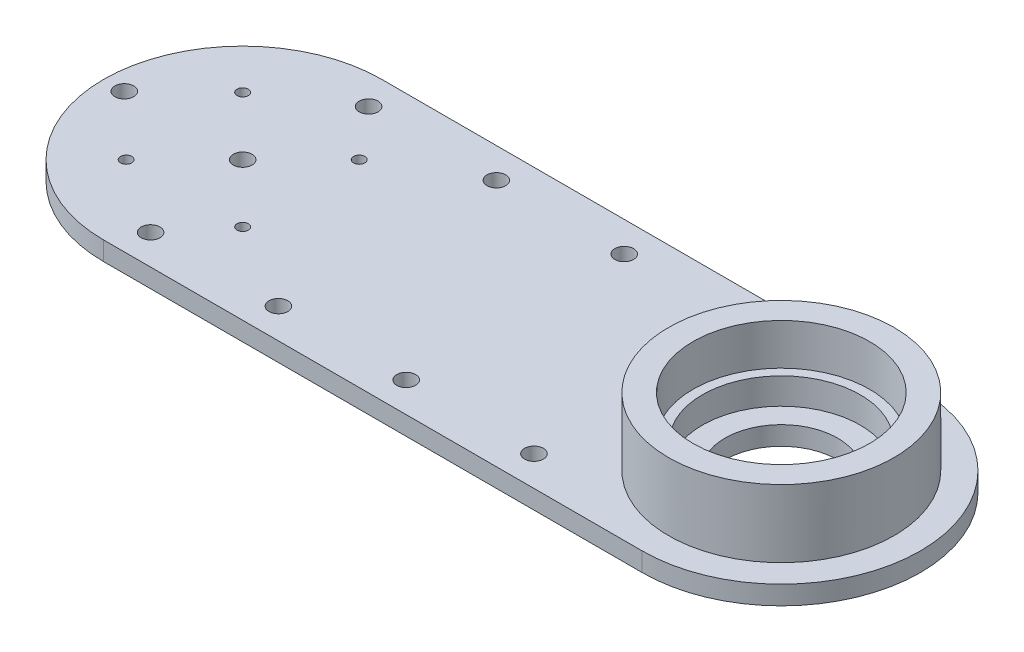
from build123d import *

# Parameters (mm, degrees)
BOSS_EXTRUDE1_DEPTH = 5
SKETCH2_R           = 2.5
SKETCH2_R_2         = 1.5
SKETCH2_R_3         = 15
CUT_EXTRUDE1_DEPTH  = 5
SKETCH3_R           = 2.5
CUT_EXTRUDE2_DEPTH  = 5
SKETCH4_R           = 23.5
SKETCH4_R_2         = 21.000952359
BOSS_EXTRUDE2_DEPTH = 7
SKETCH5_R           = 30.000666659
SKETCH5_R_2         = 23.5
BOSS_EXTRUDE3_DEPTH = 18


with BuildPart() as part:
    # Sketch1 → Boss-Extrude1 (new body)
    with BuildSketch(Plane(origin=(0, 0, 0), x_dir=(1, 0, 0), z_dir=(0, 1, 0))):
        with BuildLine():
            Line((0, 37), (143.3, 37))
            ThreePointArc((143.3, 37), (180.3, 0), (143.3, -37))
            Line((143.3, -37), (0, -37))
            ThreePointArc((0, -37), (-37, 0), (0, 37))
        make_face()
    extrude(amount=BOSS_EXTRUDE1_DEPTH)

    # Sketch2 → Cut-Extrude1 (cut)
    with BuildSketch(Plane(origin=(0, 5, 0), x_dir=(1, 0, 0), z_dir=(0, 1, 0))):
        with Locations(Location((0, 0, 0), (0, 0, 270))):
            Circle(SKETCH2_R)
        with Locations(Location((-15.5, 15.5, 0), (0, 0, 270))):
            Circle(SKETCH2_R_2)
        with Locations(Location((15.5, 15.5, 0), (0, 0, 270))):
            Circle(SKETCH2_R_2)
        with Locations(Location((15.5, -15.5, 0), (0, 0, 270))):
            Circle(SKETCH2_R_2)
        with Locations(Location((-15.5, -15.5, 0), (0, 0, 270))):
            Circle(SKETCH2_R_2)
        with Locations(Location((143.3, 0, 0), (0, 0, 270))):
            Circle(SKETCH2_R_3)
    extrude(amount=-CUT_EXTRUDE1_DEPTH, mode=Mode.SUBTRACT)

    # Sketch3 → Cut-Extrude2 (cut)
    with BuildSketch(Plane(origin=(0, 5, 0), x_dir=(1, 0, 0), z_dir=(0, 1, 0))):
        with Locations(Location((-31.5, 0, 0), (0, 0, 270))):
            Circle(SKETCH3_R)
        with Locations(Location((4.5, -29, 0), (0, 0, 270))):
            Circle(SKETCH3_R)
        with Locations(Location((38.5, -29, 0), (0, 0, 270))):
            Circle(SKETCH3_R)
        with Locations(Location((72.5, -29, 0), (0, 0, 270))):
            Circle(SKETCH3_R)
        with Locations(Location((106.5, -29, 0), (0, 0, 270))):
            Circle(SKETCH3_R)
        with Locations(Location((4.5, 29, 0), (0, 0, 270))):
            Circle(SKETCH3_R)
        with Locations(Location((38.5, 29, 0), (0, 0, 270))):
            Circle(SKETCH3_R)
        with Locations(Location((72.5, 29, 0), (0, 0, 270))):
            Circle(SKETCH3_R)
        with Locations(Location((106.5, 29, 0), (0, 0, 270))):
            Circle(SKETCH3_R)
    extrude(amount=-CUT_EXTRUDE2_DEPTH, mode=Mode.SUBTRACT)

    # Sketch4 → Boss-Extrude2 (add)
    with BuildSketch(Plane(origin=(0, 5, 0), x_dir=(1, 0, 0), z_dir=(0, 1, 0))):
        with Locations(Location((143.3, 0, 0), (0, 0, 270))):
            Circle(SKETCH4_R)
        with Locations(Location((143.3, 0, 0), (0, 0, 270))):
            Circle(SKETCH4_R_2, mode=Mode.SUBTRACT)
    extrude(amount=BOSS_EXTRUDE2_DEPTH)

    # Sketch5 → Boss-Extrude3 (add)
    with BuildSketch(Plane(origin=(0, 5, 0), x_dir=(1, 0, 0), z_dir=(0, 1, 0))):
        with Locations(Location((143.3, 0, 0), (0, 0, 90))):
            Circle(SKETCH5_R)
        with Locations(Location((143.3, 0, 0), (0, 0, 270))):
            Circle(SKETCH5_R_2, mode=Mode.SUBTRACT)
    extrude(amount=BOSS_EXTRUDE3_DEPTH)


solid = part.part
